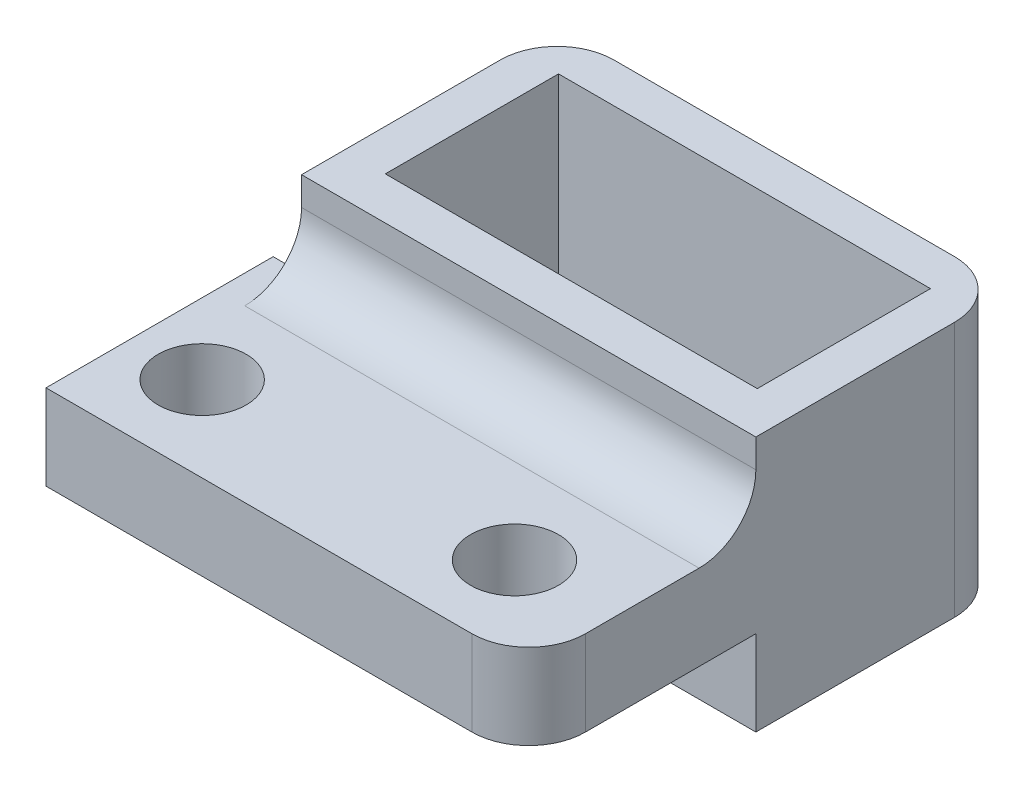
from build123d import *

# Parameters (mm, degrees)
CROQUIS1_W              = 18
CROQUIS1_H              = 18
CROQUIS1_R              = 1.55
SALIENTE_EXTRUIR1_DEPTH = 3
CROQUIS3_W              = 18
CROQUIS3_H              = 10
SALIENTE_EXTRUIR3_DEPTH = 3
CORTAR_EXTRUIR1_REACH   = 28.153
CROQUIS4_W              = 2
CROQUIS4_H              = 10
CROQUIS7_W              = 13.1
CROQUIS7_H              = 6.1
CORTAR_EXTRUIR2_DEPTH   = 6
CROQUIS9_W              = 16
CROQUIS9_H              = 10
CROQUIS9_W_2            = 13.1
CROQUIS9_H_2            = 6.1
SALIENTE_EXTRUIR4_DEPTH = 3
CROQUIS10_W             = 13.1
CROQUIS10_H             = 6.1
CROQUIS10_W_2           = 11.6
CROQUIS10_H_2           = 4.6
SALIENTE_EXTRUIR6_DEPTH = 2.5
CROQUIS11_W             = 16
CROQUIS11_H             = 1
CORTAR_EXTRUIR4_DEPTH   = 9
REDONDEO1_R             = 2
CROQUIS12_W             = 8
CROQUIS12_H             = 3
CORTAR_EXTRUIR5_DEPTH   = 1
REDONDEO2_R             = 2


with BuildPart() as part:
    # Croquis1 → Saliente-Extruir1 (new body)
    with BuildSketch(Plane(origin=(0, 0, 0), x_dir=(1, 0, 0), z_dir=(0, 1, 0))):
        with Locations((9, 9)):
            Rectangle(CROQUIS1_W, CROQUIS1_H)
        with Locations(Location((3.5, 3, 0), (0, 0, 270))):
            Circle(CROQUIS1_R, mode=Mode.SUBTRACT)
        with Locations(Location((14.5, 3, 0), (0, 0, 270))):
            Circle(CROQUIS1_R, mode=Mode.SUBTRACT)
    extrude(amount=SALIENTE_EXTRUIR1_DEPTH)

    # Croquis3 → Saliente-Extruir3 (add)
    with BuildSketch(Plane(origin=(0, 3, 0), x_dir=(1, 0, 0), z_dir=(0, 1, 0))):
        with Locations((9, 13)):
            Rectangle(CROQUIS3_W, CROQUIS3_H)
    extrude(amount=SALIENTE_EXTRUIR3_DEPTH)

    # Cortar-Extruir1: up to this face of the body (flat: up to its plane)
    cortar_extruir1_end = Plane(part.part.faces().sort_by_distance((9, 6, -13))[0])
    # Croquis4 → Cortar-Extruir1 (cut, up to the picked face)
    with BuildSketch(Plane.XZ, mode=Mode.PRIVATE) as cortar_extruir1_sk1:
        with Locations((1, -13)):
            Rectangle(CROQUIS4_W, CROQUIS4_H)
    cortar_extruir1_tool1 = split(extrude(cortar_extruir1_sk1.sketch, amount=-CORTAR_EXTRUIR1_REACH, mode=Mode.PRIVATE), bisect_by=cortar_extruir1_end, keep=Keep.BOTH, mode=Mode.PRIVATE)
    add(cortar_extruir1_tool1.solids().sort_by(Axis((1, 0, -13), (0, 1, 0)))[0], mode=Mode.SUBTRACT)

    # Croquis7 → Cortar-Extruir2 (cut)
    with BuildSketch(Plane(origin=(0, 6, 0), x_dir=(1, 0, 0), z_dir=(0, 1, 0))):
        with Locations((10, 12.55)):
            Rectangle(CROQUIS7_W, CROQUIS7_H)
    extrude(amount=-CORTAR_EXTRUIR2_DEPTH, mode=Mode.SUBTRACT)

    # Croquis9 → Saliente-Extruir4 (add)
    with BuildSketch(Plane.XZ):
        with Locations((10, -13)):
            Rectangle(CROQUIS9_W, CROQUIS9_H)
        with Locations((10, -12.55)):
            Rectangle(CROQUIS9_W_2, CROQUIS9_H_2, mode=Mode.SUBTRACT)
    extrude(amount=SALIENTE_EXTRUIR4_DEPTH)

    # Croquis10 → Saliente-Extruir6 (add)
    with BuildSketch(Plane.XZ.offset(3)):
        with Locations((10, -12.55)):
            Rectangle(CROQUIS10_W, CROQUIS10_H)
        with Locations((10, -12.55)):
            Rectangle(CROQUIS10_W_2, CROQUIS10_H_2, mode=Mode.SUBTRACT)
    extrude(amount=-SALIENTE_EXTRUIR6_DEPTH)

    # Croquis11 → Cortar-Extruir4 (cut)
    with BuildSketch(Plane(origin=(0, 6, 0), x_dir=(1, 0, 0), z_dir=(0, 1, 0))):
        with Locations((10, 17.5)):
            Rectangle(CROQUIS11_W, CROQUIS11_H)
    extrude(amount=-CORTAR_EXTRUIR4_DEPTH, mode=Mode.SUBTRACT)

    # Redondeo1
    redondeo1_edges = [part.edges().sort_by_distance(p)[0] for p in [
        (18, 1.5, -17),
        (2, 1.5, -17),
        (18, 1.5, 0),
    ]]
    fillet(redondeo1_edges, radius=REDONDEO1_R)

    # Croquis12 → Cortar-Extruir5 (cut)
    with BuildSketch(Plane.ZY):
        with Locations((-4, 1.5)):
            Rectangle(CROQUIS12_W, CROQUIS12_H)
    extrude(amount=-CORTAR_EXTRUIR5_DEPTH, mode=Mode.SUBTRACT)

    # Redondeo2
    redondeo2_edges = [part.edges().sort_by_distance(p)[0] for p in [
        (10, 3, -8),
    ]]
    fillet(redondeo2_edges, radius=REDONDEO2_R)


solid = part.part
